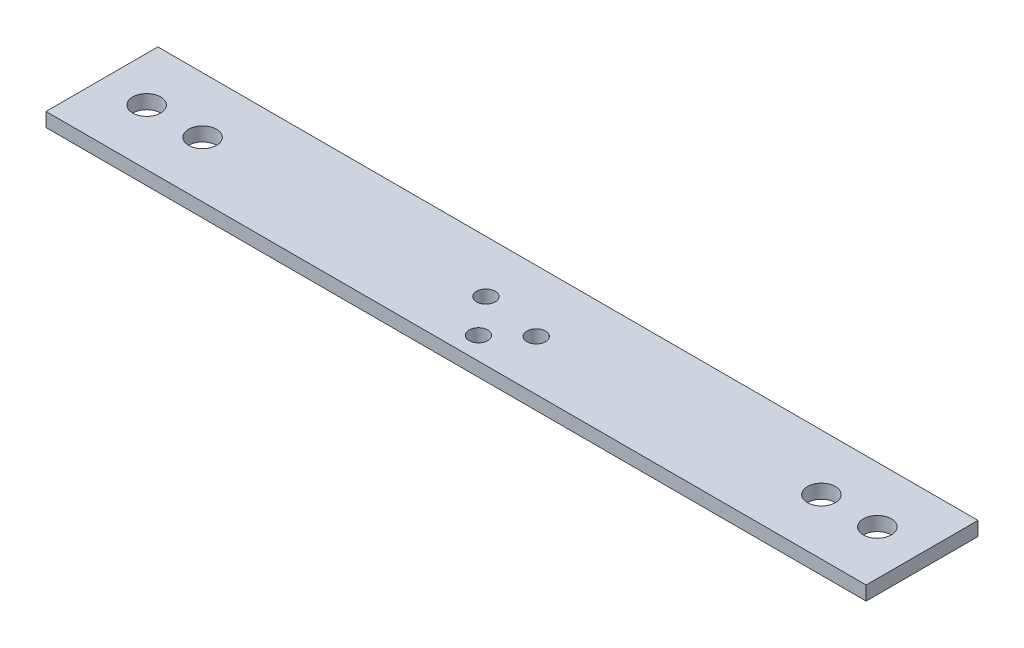
from build123d import *

# Parameters (mm, degrees)
SKETCH2_W           = 279.4
SKETCH2_H           = 38.1
SKETCH2_R           = 4.7625
SKETCH2_R_2         = 3.175
BOSS_EXTRUDE1_DEPTH = 4.7625


with BuildPart() as part:
    # Sketch2 → Boss-Extrude1 (new body)
    with BuildSketch(Plane(origin=(0, 0, 0), x_dir=(1, 0, 0), z_dir=(0, 1, 0))):
        Rectangle(SKETCH2_W, SKETCH2_H)
        with Locations(Location((-124.46, 0, 0), (0, 0, 90))):
            Circle(SKETCH2_R, mode=Mode.SUBTRACT)
        with Locations(Location((-105.41, 0, 0), (0, 0, 90))):
            Circle(SKETCH2_R, mode=Mode.SUBTRACT)
        with Locations(Location((124.46, 0, 0), (0, 0, 90))):
            Circle(SKETCH2_R, mode=Mode.SUBTRACT)
        with Locations(Location((105.41, 0, 0), (0, 0, 90))):
            Circle(SKETCH2_R, mode=Mode.SUBTRACT)
        with Locations(Location((0, -11.43, 0), (0, 0, 90))):
            Circle(SKETCH2_R_2, mode=Mode.SUBTRACT)
        with Locations(Location((-10.16, 1.27, 0), (0, 0, 90))):
            Circle(SKETCH2_R_2, mode=Mode.SUBTRACT)
        with Locations(Location((10.16, -1.905, 0), (0, 0, 90))):
            Circle(SKETCH2_R_2, mode=Mode.SUBTRACT)
    extrude(amount=BOSS_EXTRUDE1_DEPTH)


solid = part.part
